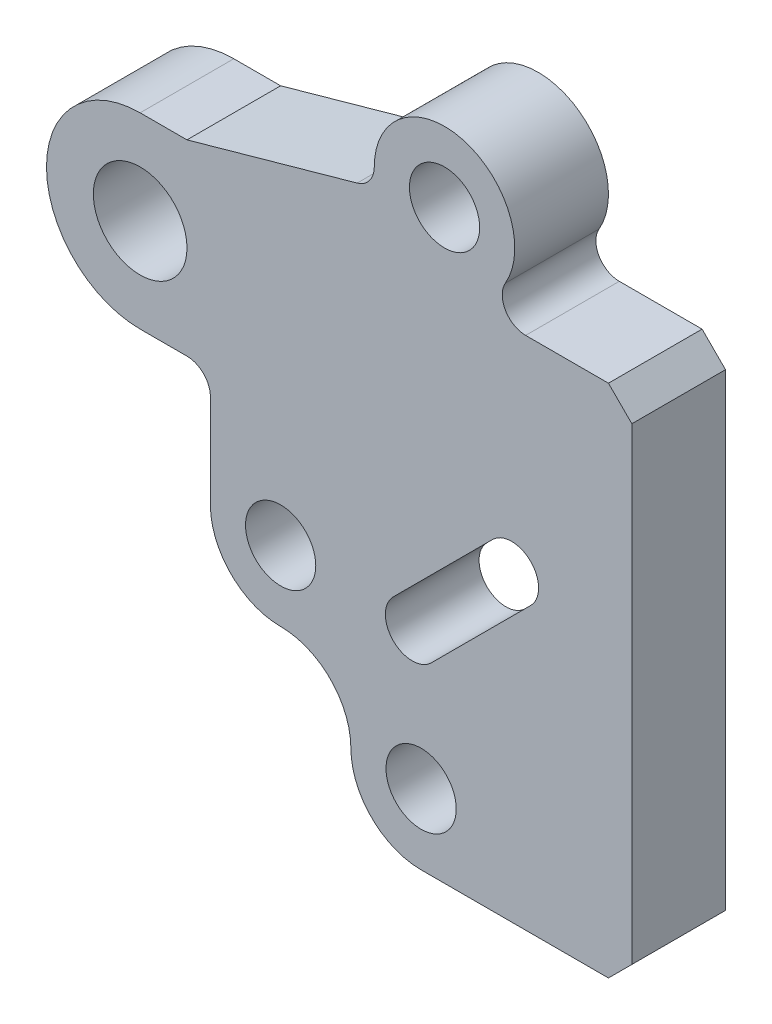
from build123d import *

# Parameters (mm, degrees)
SKETCH1_R           = 7.5
SKETCH1_R_2         = 10
BOSS_EXTRUDE1_DEPTH = 10


with BuildPart() as part:
    # Sketch1 → Boss-Extrude1 (new, symmetric)
    with BuildSketch(Plane.XY):
        with BuildLine():
            ThreePointArc((0, 20), (-20, 0), (0, -20))
            Line((0, -20), (10, -20))
            ThreePointArc((10, -20), (13.535533906, -21.464466094), (15, -25))
            Line((15, -25), (15, -45))
            ThreePointArc((15, -45), (19.393398282, -55.606601718), (30, -60))
            ThreePointArc((30, -60), (40.606601718, -64.393398282), (45, -75))
            ThreePointArc((45, -75), (49.393398282, -85.606601718), (60, -90))
            Line((60, -90), (100, -90))
            Line((100, -90), (105, -85))
            Line((105, -85), (105, 15))
            Line((105, 15), (100, 20))
            Line((100, 20), (82.320508076, 20))
            ThreePointArc((82.320508076, 20), (77.990381057, 22.5), (77.990381057, 27.5))
            ThreePointArc((77.990381057, 27.5), (68.882285677, 49.488887394), (50, 35))
            ThreePointArc((50, 35), (48.984060464, 31.978864085), (46.349095113, 30.185444737))
            Line((46.349095113, 30.185444737), (10, 20))
            Line((10, 20), (0, 20))
        make_face()
        with Locations((30, -45)):
            Circle(SKETCH1_R, mode=Mode.SUBTRACT)
        with Locations((60, -75)):
            Circle(SKETCH1_R, mode=Mode.SUBTRACT)
        with BuildLine():
            ThreePointArc((62.185835481, -50.618244574), (54.053641254, -50.618244574), (54.053641254, -42.486050347))
            Line((54.053641254, -42.486050347), (75.26684469, -21.272846911))
            ThreePointArc((75.26684469, -21.272846911), (83.399038917, -21.272846911), (83.399038917, -29.405041138))
            Line((83.399038917, -29.405041138), (62.185835481, -50.618244574))
        make_face(mode=Mode.SUBTRACT)
        Circle(SKETCH1_R_2, mode=Mode.SUBTRACT)
        with Locations((65, 35)):
            Circle(SKETCH1_R, mode=Mode.SUBTRACT)
    extrude(amount=BOSS_EXTRUDE1_DEPTH, both=True)


solid = part.part
